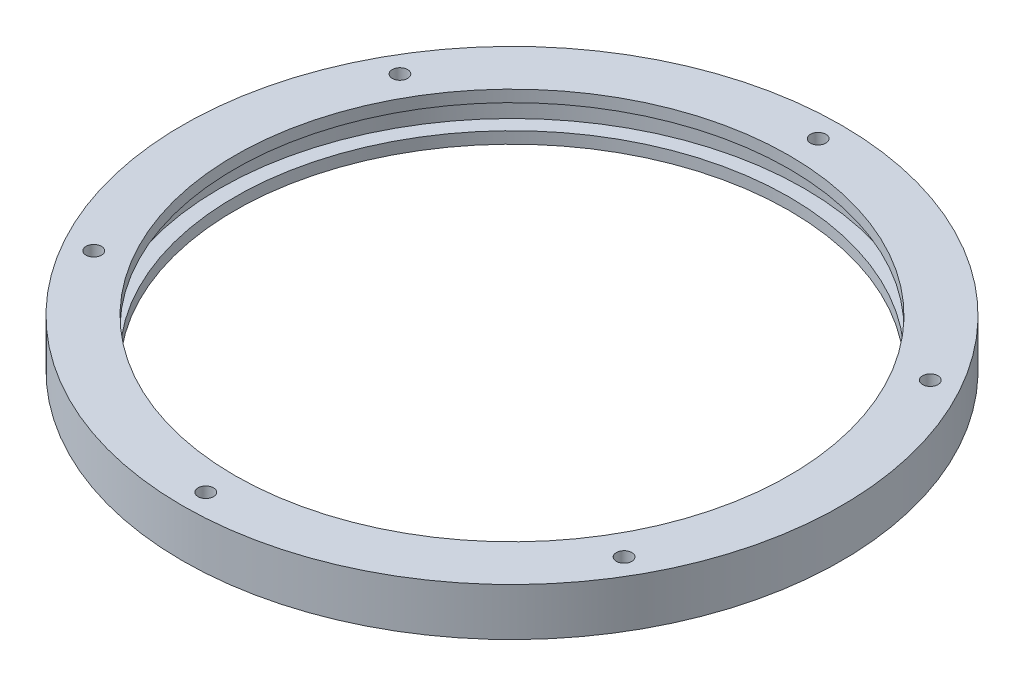
from build123d import *

# Parameters (mm, degrees)
CIRPATTERN1_COUNT = 6


with BuildPart() as part:
    # Sketch2 → Revolve1 (revolve)
    with BuildSketch(Plane.XY, mode=Mode.PRIVATE) as revolve1_sk:
        Polygon((59.3, 0), (59.3, 2.5), (62.5, 2.5), (62.5, 7.7), (59.3, 7.7), (59.3, 10.2), (70.5, 10.2), (70.5, 0), align=None)
    revolve(revolve1_sk.sketch.rotate(Axis((0, 5.1, 0), (0, 1, 0)), 90), axis=Axis((0, 5.1, 0), (0, 1, 0)))

    # Sketch4 → M4 Tapped Hole1 (revolve, cut)
    with BuildSketch(Plane(origin=(0, 10.2, -65.5), x_dir=(0, 0, 1), z_dir=(1, 0, 0))):
        Polygon((0, 0), (0, 8.991420021), (1.65, 8), (1.65, 0), align=None)
    m4_tapped_hole1 = revolve(axis=Axis((0, 16.55, -65.5), (0, -1, 0)), mode=Mode.SUBTRACT)

    # CirPattern1: M4 Tapped Hole1 ×6 about axis
    cirpattern1_axis = Axis((0, 0, 0), (0, 1, 0))
    for i in range(1, CIRPATTERN1_COUNT):
        add(m4_tapped_hole1.rotate(cirpattern1_axis, i * 360 / CIRPATTERN1_COUNT), mode=Mode.SUBTRACT)


solid = part.part
